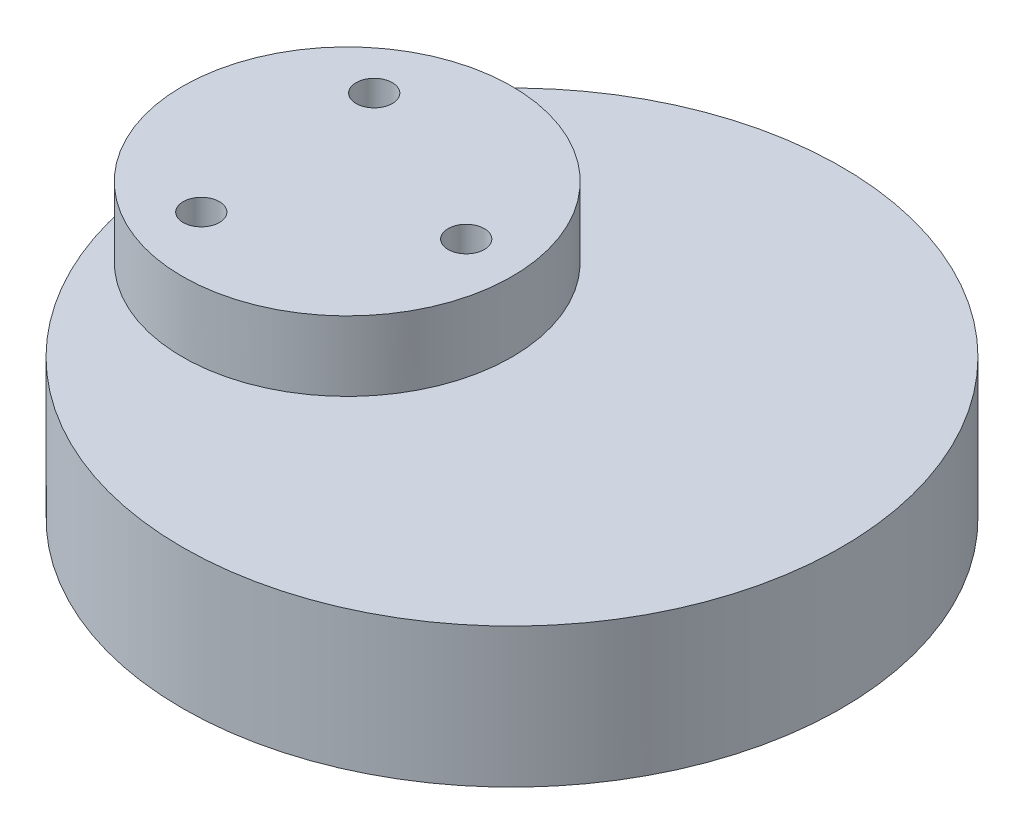
from build123d import *

# Parameters (mm, degrees)
BOSS_EXTRUDE1_DEPTH       = 6.35
SKETCH2_3_R               = 30
BOSS_EXTRUDE2_DEPTH       = 12.7
M4X0_7_TAPPED_HOLE1_D     = 3.3
M4X0_7_TAPPED_HOLE1_DEPTH = 10.1
M4X0_7_TAPPED_HOLE1_TIP   = 0.991420021
M4X0_7_TAPPED_HOLE3_D     = 3.3
M4X0_7_TAPPED_HOLE3_DEPTH = 10.1
M4X0_7_TAPPED_HOLE3_TIP   = 0.991420021


with BuildPart() as part:
    # Sketch2 → Boss-Extrude1 (new body)
    with BuildSketch(Plane(origin=(0, 0, 0), x_dir=(1, 0, 0), z_dir=(0, 1, 0))):
        with BuildLine():
            ThreePointArc((-15, 0), (0, -15), (15, 0))
            ThreePointArc((15, 0), (0, 15), (-15, 0))
        make_face()
    extrude(amount=BOSS_EXTRUDE1_DEPTH)

    # Sketch2<3> → Boss-Extrude2 (add)
    with BuildSketch(Plane(origin=(0, 0, 0), x_dir=(1, 0, 0), z_dir=(0, 1, 0))):
        with Locations((15, 0)):
            Circle(SKETCH2_3_R)
    extrude(amount=-BOSS_EXTRUDE2_DEPTH)

    # M4x0.7 Tapped Hole1
    with Locations(Plane(origin=(0, 6.35, 0), x_dir=(1, 0, 0), z_dir=(0, 1, 0))):
        with Locations((-4.226182617, -9.06307787), (9.961946981, 0.871557427), (-5.735764364, 8.191520443)):
            Hole(M4X0_7_TAPPED_HOLE1_D / 2, depth=M4X0_7_TAPPED_HOLE1_DEPTH)
            with Locations((0, 0, -(M4X0_7_TAPPED_HOLE1_DEPTH + M4X0_7_TAPPED_HOLE1_TIP / 2))):  # 118° drill point
                Cone(0, M4X0_7_TAPPED_HOLE1_D / 2, M4X0_7_TAPPED_HOLE1_TIP, mode=Mode.SUBTRACT)

    # M4x0.7 Tapped Hole3
    with Locations(Plane(origin=(0, -12.7, 0), x_dir=(-1, 0, 0), z_dir=(0, -1, 0))):
        with Locations((-15, -20), (2.320508076, 10), (-32.320508076, 10)):
            Hole(M4X0_7_TAPPED_HOLE3_D / 2, depth=M4X0_7_TAPPED_HOLE3_DEPTH)
            with Locations((0, 0, -(M4X0_7_TAPPED_HOLE3_DEPTH + M4X0_7_TAPPED_HOLE3_TIP / 2))):  # 118° drill point
                Cone(0, M4X0_7_TAPPED_HOLE3_D / 2, M4X0_7_TAPPED_HOLE3_TIP, mode=Mode.SUBTRACT)


solid = part.part
